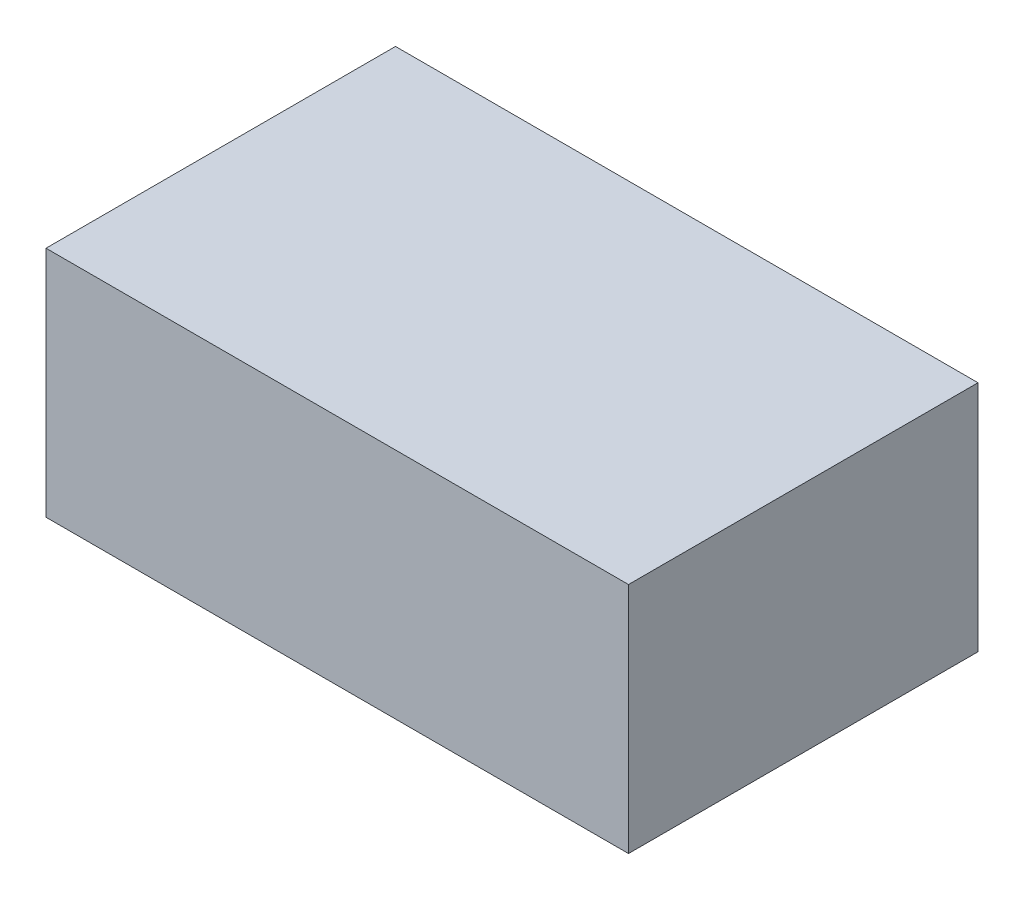
from build123d import *

# Parameters (mm, degrees)
SKETCH1_W           = 5
SKETCH1_H           = 3
BOSS_EXTRUDE1_DEPTH = 2


with BuildPart() as part:
    # Sketch1 → Boss-Extrude1 (new body)
    with BuildSketch(Plane(origin=(0, 20, 0), x_dir=(1, 0, 0), z_dir=(0, 1, 0))):
        with Locations((-28.213561031, 49.956924968)):
            Rectangle(SKETCH1_W, SKETCH1_H)
    extrude(amount=BOSS_EXTRUDE1_DEPTH)


solid = part.part
